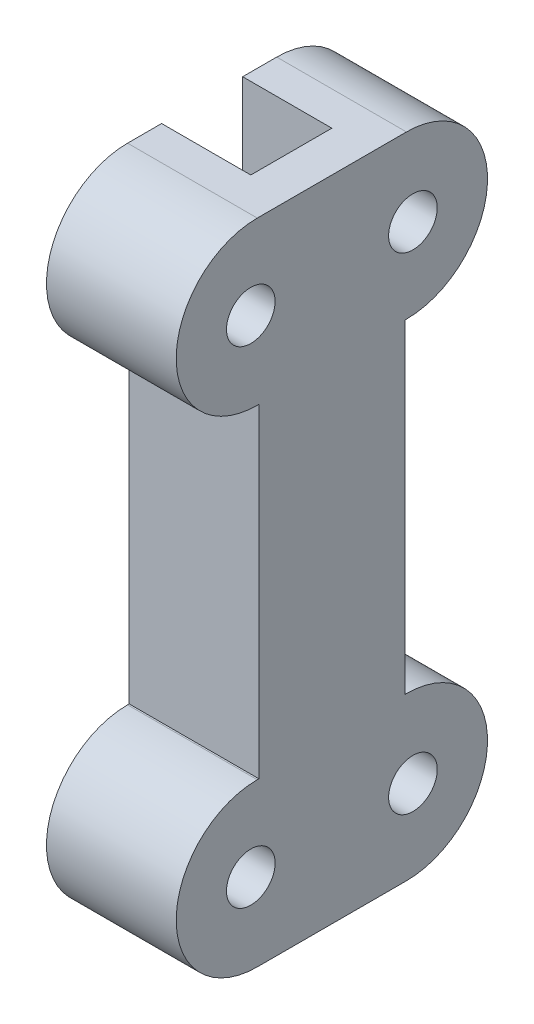
from build123d import *

# Parameters (mm, degrees)
ESQUISSE2_W               = 9
ESQUISSE2_H               = 40
BOSS_EXTRU_1_DEPTH        = 8
ESQUISSE3_W               = 5
ESQUISSE3_H               = 40
ENL_V_MAT_EXTRU_1_DEPTH   = 5.5
ESQUISSE4_W               = 8
ESQUISSE4_H               = 10
BOSS_EXTRU_2_DEPTH        = 0.1
BOSS_EXTRU_5_DEPTH        = 8
ESQUISSE14_R              = 1.5
ENL_V_MAT_EXTRU_4_DEPTH   = 24.583044757
SYM_TRIE5_COPY_1_SKETCH_W = 8
SYM_TRIE5_COPY_1_SKETCH_H = 10
SYM_TRIE5_COPY_1_DEPTH    = 0.1
SYM_TRIE5_COPY_2_DEPTH    = 8
SYM_TRIE5_COPY_3_SKETCH_R = 1.5
SYM_TRIE5_COPY_3_DEPTH    = 24.583044757


with BuildPart() as part:
    # Esquisse2 → Boss.-Extru.1 (new body)
    with BuildSketch(Plane(origin=(0, 0, 0), x_dir=(0, 0, -1), z_dir=(1, 0, 0))):
        Rectangle(ESQUISSE2_W, ESQUISSE2_H)
    extrude(amount=BOSS_EXTRU_1_DEPTH)

    # Esquisse3 → Enlèv. mat.-Extru.1 (cut)
    with BuildSketch(Plane.ZY):
        Rectangle(ESQUISSE3_W, ESQUISSE3_H)
    extrude(amount=-ENL_V_MAT_EXTRU_1_DEPTH, mode=Mode.SUBTRACT)

    # Esquisse4 → Boss.-Extru.2 (add)
    with BuildSketch(Plane(origin=(0, 0, -4.5), x_dir=(-1, 0, 0), z_dir=(0, 0, -1))):
        with Locations((-4, 15)):
            Rectangle(ESQUISSE4_W, ESQUISSE4_H)
    boss_extru_2 = extrude(amount=BOSS_EXTRU_2_DEPTH)

    # Esquisse13 → Boss.-Extru.5 (add)
    with BuildSketch(Plane(origin=(0, 0, 0), x_dir=(0, 0, -1), z_dir=(1, 0, 0))):
        with BuildLine():
            Line((4.6, 10), (4.6, 20))
            ThreePointArc((4.6, 20), (9.6, 15), (4.6, 10))
        make_face()
    boss_extru_5 = extrude(amount=BOSS_EXTRU_5_DEPTH)

    # Esquisse14 → Enlèv. mat.-Extru.4 (cut, through all)
    with BuildSketch(Plane.ZY):
        with Locations((-5, 15)):
            Circle(ESQUISSE14_R)
    enl_v_mat_extru_4 = extrude(amount=-ENL_V_MAT_EXTRU_4_DEPTH, mode=Mode.SUBTRACT)

    # Symétrie4: Boss.-Extru.2, Boss.-Extru.5, Enlèv. mat.-Extru.4 across plane
    add(boss_extru_2.mirror(Plane.XY))
    add(boss_extru_5.mirror(Plane.XY))
    add(enl_v_mat_extru_4.mirror(Plane.XY), mode=Mode.SUBTRACT)

    # Symétrie5: Boss.-Extru.2, Boss.-Extru.5, Enlèv. mat.-Extru.4 across plane
    add(boss_extru_2.mirror(Plane.ZX))
    add(boss_extru_5.mirror(Plane.ZX))
    add(enl_v_mat_extru_4.mirror(Plane.ZX), mode=Mode.SUBTRACT)

    # Symétrie5 copy 1 sketch → Symétrie5 copy 1 (add)
    with BuildSketch(Plane(origin=(0, 0, 4.5), x_dir=(-1, 0, 0), z_dir=(0, 0, 1))):
        with Locations((-4, 15)):
            Rectangle(SYM_TRIE5_COPY_1_SKETCH_W, SYM_TRIE5_COPY_1_SKETCH_H)
    extrude(amount=SYM_TRIE5_COPY_1_DEPTH)

    # Symétrie5 copy 2 sketch → Symétrie5 copy 2 (add)
    with BuildSketch(Plane(origin=(0, 0, 0), x_dir=(0, 0, 1), z_dir=(1, 0, 0))):
        with BuildLine():
            Line((4.6, 10), (4.6, 20))
            ThreePointArc((4.6, 20), (9.6, 15), (4.6, 10))
        make_face()
    extrude(amount=SYM_TRIE5_COPY_2_DEPTH)

    # Symétrie5 copy 3 sketch → Symétrie5 copy 3 (cut, through all)
    with BuildSketch(Plane(origin=(0, 0, 0), x_dir=(0, 0, -1), z_dir=(-1, 0, 0))):
        with Locations((-5, 15)):
            Circle(SYM_TRIE5_COPY_3_SKETCH_R)
    extrude(amount=-SYM_TRIE5_COPY_3_DEPTH, mode=Mode.SUBTRACT)


solid = part.part
